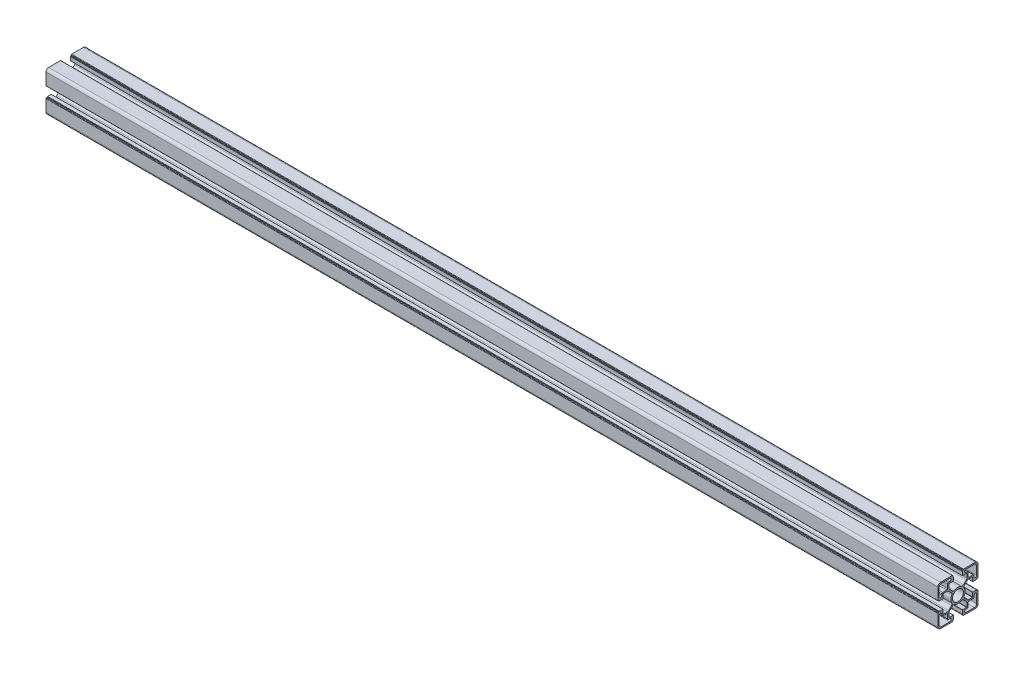
from build123d import *

# Parameters (mm, degrees)
BOSS_EXTRUDE2_DEPTH = 500


with BuildPart() as part:
    # Sketch1 → Boss-Extrude2 (new, symmetric)
    with BuildSketch(Plane(origin=(0, 0, 0), x_dir=(0, 0, -1), z_dir=(1, 0, 0))):
        with BuildLine():
            Line((-22.5, 19.5), (-22.5, 6.3))
            ThreePointArc((-22.5, 6.3), (-22.353553391, 5.946446609), (-22, 5.8))
            Line((-22, 5.8), (-21.3, 5.8))
            ThreePointArc((-21.3, 5.8), (-21.087867966, 5.712132034), (-21, 5.5))
            Line((-21, 5.5), (-21, 5.3))
            ThreePointArc((-21, 5.3), (-20.912132034, 5.087867966), (-20.7, 5))
            Line((-20.7, 5), (-16.7, 5))
            ThreePointArc((-16.7, 5), (-16.558578644, 5.058578644), (-16.5, 5.2))
            Line((-16.5, 5.2), (-16.5, 9.8))
            ThreePointArc((-16.5, 9.8), (-16.441421356, 9.941421356), (-16.3, 10))
            Line((-16.3, 10), (-11.864234483, 10))
            ThreePointArc((-11.864234483, 10), (-11.121828624, 9.852326293), (-10.492447327, 9.431787156))
            Line((-10.492447327, 9.431787156), (-7.296699127, 6.236038955))
            ThreePointArc((-7.296699127, 6.236038955), (-6.746669172, 5.129240469), (-6.976648919, 3.914890784))
            ThreePointArc((-6.976648919, 3.914890784), (-7.739935121, 2.023216331), (-8, 0))
            ThreePointArc((-8, 0), (-7.739935121, -2.023216331), (-6.976648919, -3.914890784))
            ThreePointArc((-6.976648919, -3.914890784), (-6.746669172, -5.129240469), (-7.296699127, -6.236038955))
            Line((-7.296699127, -6.236038955), (-10.492447327, -9.431787156))
            ThreePointArc((-10.492447327, -9.431787156), (-11.121828624, -9.852326293), (-11.864234483, -10))
            Line((-11.864234483, -10), (-16.3, -10))
            ThreePointArc((-16.3, -10), (-16.441421356, -9.941421356), (-16.5, -9.8))
            Line((-16.5, -9.8), (-16.5, -5.2))
            ThreePointArc((-16.5, -5.2), (-16.558578644, -5.058578644), (-16.7, -5))
            Line((-16.7, -5), (-20.7, -5))
            ThreePointArc((-20.7, -5), (-20.912132034, -5.087867966), (-21, -5.3))
            Line((-21, -5.3), (-21, -5.5))
            ThreePointArc((-21, -5.5), (-21.087867966, -5.712132034), (-21.3, -5.8))
            Line((-21.3, -5.8), (-22, -5.8))
            ThreePointArc((-22, -5.8), (-22.353553391, -5.946446609), (-22.5, -6.3))
            Line((-22.5, -6.3), (-22.5, -19.5))
            ThreePointArc((-22.5, -19.5), (-21.621320344, -21.621320344), (-19.5, -22.5))
            Line((-19.5, -22.5), (-6.3, -22.5))
            ThreePointArc((-6.3, -22.5), (-5.946446609, -22.353553391), (-5.8, -22))
            Line((-5.8, -22), (-5.8, -21.3))
            ThreePointArc((-5.8, -21.3), (-5.712132034, -21.087867966), (-5.5, -21))
            Line((-5.5, -21), (-5.3, -21))
            ThreePointArc((-5.3, -21), (-5.087867966, -20.912132034), (-5, -20.7))
            Line((-5, -20.7), (-5, -16.7))
            ThreePointArc((-5, -16.7), (-5.058578644, -16.558578644), (-5.2, -16.5))
            Line((-5.2, -16.5), (-9.8, -16.5))
            ThreePointArc((-9.8, -16.5), (-9.941421356, -16.441421356), (-10, -16.3))
            Line((-10, -16.3), (-10, -11.864234483))
            ThreePointArc((-10, -11.864234483), (-9.852326293, -11.121828624), (-9.431787156, -10.492447327))
            Line((-9.431787156, -10.492447327), (-6.236038955, -7.296699127))
            ThreePointArc((-6.236038955, -7.296699127), (-5.129240469, -6.746669172), (-3.914890784, -6.976648919))
            ThreePointArc((-3.914890784, -6.976648919), (-2.023216331, -7.739935121), (0, -8))
            ThreePointArc((0, -8), (2.023216331, -7.739935121), (3.914890784, -6.976648919))
            ThreePointArc((3.914890784, -6.976648919), (5.129240469, -6.746669172), (6.236038955, -7.296699127))
            Line((6.236038955, -7.296699127), (9.431787156, -10.492447327))
            ThreePointArc((9.431787156, -10.492447327), (9.852326293, -11.121828624), (10, -11.864234483))
            Line((10, -11.864234483), (10, -16.3))
            ThreePointArc((10, -16.3), (9.941421356, -16.441421356), (9.8, -16.5))
            Line((9.8, -16.5), (5.2, -16.5))
            ThreePointArc((5.2, -16.5), (5.058578644, -16.558578644), (5, -16.7))
            Line((5, -16.7), (5, -20.7))
            ThreePointArc((5, -20.7), (5.087867966, -20.912132034), (5.3, -21))
            Line((5.3, -21), (5.5, -21))
            ThreePointArc((5.5, -21), (5.712132034, -21.087867966), (5.8, -21.3))
            Line((5.8, -21.3), (5.8, -22))
            ThreePointArc((5.8, -22), (5.946446609, -22.353553391), (6.3, -22.5))
            Line((6.3, -22.5), (19.5, -22.5))
            ThreePointArc((19.5, -22.5), (21.621320344, -21.621320344), (22.5, -19.5))
            Line((22.5, -19.5), (22.5, -6.3))
            ThreePointArc((22.5, -6.3), (22.353553391, -5.946446609), (22, -5.8))
            Line((22, -5.8), (21.3, -5.8))
            ThreePointArc((21.3, -5.8), (21.087867966, -5.712132034), (21, -5.5))
            Line((21, -5.5), (21, -5.3))
            ThreePointArc((21, -5.3), (20.912132034, -5.087867966), (20.7, -5))
            Line((20.7, -5), (16.7, -5))
            ThreePointArc((16.7, -5), (16.558578644, -5.058578644), (16.5, -5.2))
            Line((16.5, -5.2), (16.5, -9.8))
            ThreePointArc((16.5, -9.8), (16.441421356, -9.941421356), (16.3, -10))
            Line((16.3, -10), (11.864234483, -10))
            ThreePointArc((11.864234483, -10), (11.121828624, -9.852326293), (10.492447327, -9.431787156))
            Line((10.492447327, -9.431787156), (7.296699127, -6.236038955))
            ThreePointArc((7.296699127, -6.236038955), (6.746669172, -5.129240469), (6.976648919, -3.914890784))
            ThreePointArc((6.976648919, -3.914890784), (7.739935121, -2.023216331), (8, 0))
            ThreePointArc((8, 0), (7.739935121, 2.023216331), (6.976648919, 3.914890784))
            ThreePointArc((6.976648919, 3.914890784), (6.746669172, 5.129240469), (7.296699127, 6.236038955))
            Line((7.296699127, 6.236038955), (10.492447327, 9.431787156))
            ThreePointArc((10.492447327, 9.431787156), (11.121828624, 9.852326293), (11.864234483, 10))
            Line((11.864234483, 10), (16.3, 10))
            ThreePointArc((16.3, 10), (16.441421356, 9.941421356), (16.5, 9.8))
            Line((16.5, 9.8), (16.5, 5.2))
            ThreePointArc((16.5, 5.2), (16.558578644, 5.058578644), (16.7, 5))
            Line((16.7, 5), (20.7, 5))
            ThreePointArc((20.7, 5), (20.912132034, 5.087867966), (21, 5.3))
            Line((21, 5.3), (21, 5.5))
            ThreePointArc((21, 5.5), (21.087867966, 5.712132034), (21.3, 5.8))
            Line((21.3, 5.8), (22, 5.8))
            ThreePointArc((22, 5.8), (22.353553391, 5.946446609), (22.5, 6.3))
            Line((22.5, 6.3), (22.5, 19.5))
            ThreePointArc((22.5, 19.5), (21.621320344, 21.621320344), (19.5, 22.5))
            Line((19.5, 22.5), (6.3, 22.5))
            ThreePointArc((6.3, 22.5), (5.946446609, 22.353553391), (5.8, 22))
            Line((5.8, 22), (5.8, 21.3))
            ThreePointArc((5.8, 21.3), (5.712132034, 21.087867966), (5.5, 21))
            Line((5.5, 21), (5.3, 21))
            ThreePointArc((5.3, 21), (5.087867966, 20.912132034), (5, 20.7))
            Line((5, 20.7), (5, 16.7))
            ThreePointArc((5, 16.7), (5.058578644, 16.558578644), (5.2, 16.5))
            Line((5.2, 16.5), (9.8, 16.5))
            ThreePointArc((9.8, 16.5), (9.941421356, 16.441421356), (10, 16.3))
            Line((10, 16.3), (10, 11.864234483))
            ThreePointArc((10, 11.864234483), (9.852326293, 11.121828624), (9.431787156, 10.492447327))
            Line((9.431787156, 10.492447327), (6.236038955, 7.296699127))
            ThreePointArc((6.236038955, 7.296699127), (5.129240469, 6.746669172), (3.914890784, 6.976648919))
            ThreePointArc((3.914890784, 6.976648919), (2.023216331, 7.739935121), (0, 8))
            ThreePointArc((0, 8), (-2.023216331, 7.739935121), (-3.914890784, 6.976648919))
            ThreePointArc((-3.914890784, 6.976648919), (-5.129240469, 6.746669172), (-6.236038955, 7.296699127))
            Line((-6.236038955, 7.296699127), (-9.431787156, 10.492447327))
            ThreePointArc((-9.431787156, 10.492447327), (-9.852326293, 11.121828624), (-10, 11.864234483))
            Line((-10, 11.864234483), (-10, 16.3))
            ThreePointArc((-10, 16.3), (-9.941421356, 16.441421356), (-9.8, 16.5))
            Line((-9.8, 16.5), (-5.2, 16.5))
            ThreePointArc((-5.2, 16.5), (-5.058578644, 16.558578644), (-5, 16.7))
            Line((-5, 16.7), (-5, 20.7))
            ThreePointArc((-5, 20.7), (-5.087867966, 20.912132034), (-5.3, 21))
            Line((-5.3, 21), (-5.5, 21))
            ThreePointArc((-5.5, 21), (-5.712132034, 21.087867966), (-5.8, 21.3))
            Line((-5.8, 21.3), (-5.8, 22))
            ThreePointArc((-5.8, 22), (-5.946446609, 22.353553391), (-6.3, 22.5))
            Line((-6.3, 22.5), (-19.5, 22.5))
            ThreePointArc((-19.5, 22.5), (-21.621320344, 21.621320344), (-22.5, 19.5))
        make_face()
        with BuildLine():
            Line((-21, 18.5), (-21, 9))
            ThreePointArc((-21, 9), (-19.5, 7.5), (-18, 9))
            Line((-18, 9), (-18, 10.5))
            ThreePointArc((-18, 10.5), (-17.707106781, 11.207106781), (-17, 11.5))
            Line((-17, 11.5), (-12.5, 11.5))
            ThreePointArc((-12.5, 11.5), (-11.792893219, 11.792893219), (-11.5, 12.5))
            Line((-11.5, 12.5), (-11.5, 17))
            ThreePointArc((-11.5, 17), (-11.207106781, 17.707106781), (-10.5, 18))
            Line((-10.5, 18), (-9, 18))
            ThreePointArc((-9, 18), (-7.5, 19.5), (-9, 21))
            Line((-9, 21), (-18.5, 21))
            ThreePointArc((-18.5, 21), (-20.267766953, 20.267766953), (-21, 18.5))
        make_face(mode=Mode.SUBTRACT)
        with BuildLine():
            Line((18.5, 21), (9, 21))
            ThreePointArc((9, 21), (7.5, 19.5), (9, 18))
            Line((9, 18), (10.5, 18))
            ThreePointArc((10.5, 18), (11.207106781, 17.707106781), (11.5, 17))
            Line((11.5, 17), (11.5, 12.5))
            ThreePointArc((11.5, 12.5), (11.792893219, 11.792893219), (12.5, 11.5))
            Line((12.5, 11.5), (17, 11.5))
            ThreePointArc((17, 11.5), (17.707106781, 11.207106781), (18, 10.5))
            Line((18, 10.5), (18, 9))
            ThreePointArc((18, 9), (19.5, 7.5), (21, 9))
            Line((21, 9), (21, 18.5))
            ThreePointArc((21, 18.5), (20.267766953, 20.267766953), (18.5, 21))
        make_face(mode=Mode.SUBTRACT)
        with BuildLine():
            Line((21, -18.5), (21, -9))
            ThreePointArc((21, -9), (19.5, -7.5), (18, -9))
            Line((18, -9), (18, -10.5))
            ThreePointArc((18, -10.5), (17.707106781, -11.207106781), (17, -11.5))
            Line((17, -11.5), (12.5, -11.5))
            ThreePointArc((12.5, -11.5), (11.792893219, -11.792893219), (11.5, -12.5))
            Line((11.5, -12.5), (11.5, -17))
            ThreePointArc((11.5, -17), (11.207106781, -17.707106781), (10.5, -18))
            Line((10.5, -18), (9, -18))
            ThreePointArc((9, -18), (7.5, -19.5), (9, -21))
            Line((9, -21), (18.5, -21))
            ThreePointArc((18.5, -21), (20.267766953, -20.267766953), (21, -18.5))
        make_face(mode=Mode.SUBTRACT)
        with BuildLine():
            Line((-18.5, -21), (-9, -21))
            ThreePointArc((-9, -21), (-7.5, -19.5), (-9, -18))
            Line((-9, -18), (-10.5, -18))
            ThreePointArc((-10.5, -18), (-11.207106781, -17.707106781), (-11.5, -17))
            Line((-11.5, -17), (-11.5, -12.5))
            ThreePointArc((-11.5, -12.5), (-11.792893219, -11.792893219), (-12.5, -11.5))
            Line((-12.5, -11.5), (-17, -11.5))
            ThreePointArc((-17, -11.5), (-17.707106781, -11.207106781), (-18, -10.5))
            Line((-18, -10.5), (-18, -9))
            ThreePointArc((-18, -9), (-19.5, -7.5), (-21, -9))
            Line((-21, -9), (-21, -18.5))
            ThreePointArc((-21, -18.5), (-20.267766953, -20.267766953), (-18.5, -21))
        make_face(mode=Mode.SUBTRACT)
        with BuildLine():
            ThreePointArc((0, 6.1), (-4.313351365, 4.313351365), (-6.1, 0))
            ThreePointArc((-6.1, 0), (-4.313351365, -4.313351365), (0, -6.1))
            ThreePointArc((0, -6.1), (4.313351365, -4.313351365), (6.1, 0))
            ThreePointArc((6.1, 0), (4.313351365, 4.313351365), (0, 6.1))
        make_face(mode=Mode.SUBTRACT)
    extrude(amount=BOSS_EXTRUDE2_DEPTH, both=True)


solid = part.part
